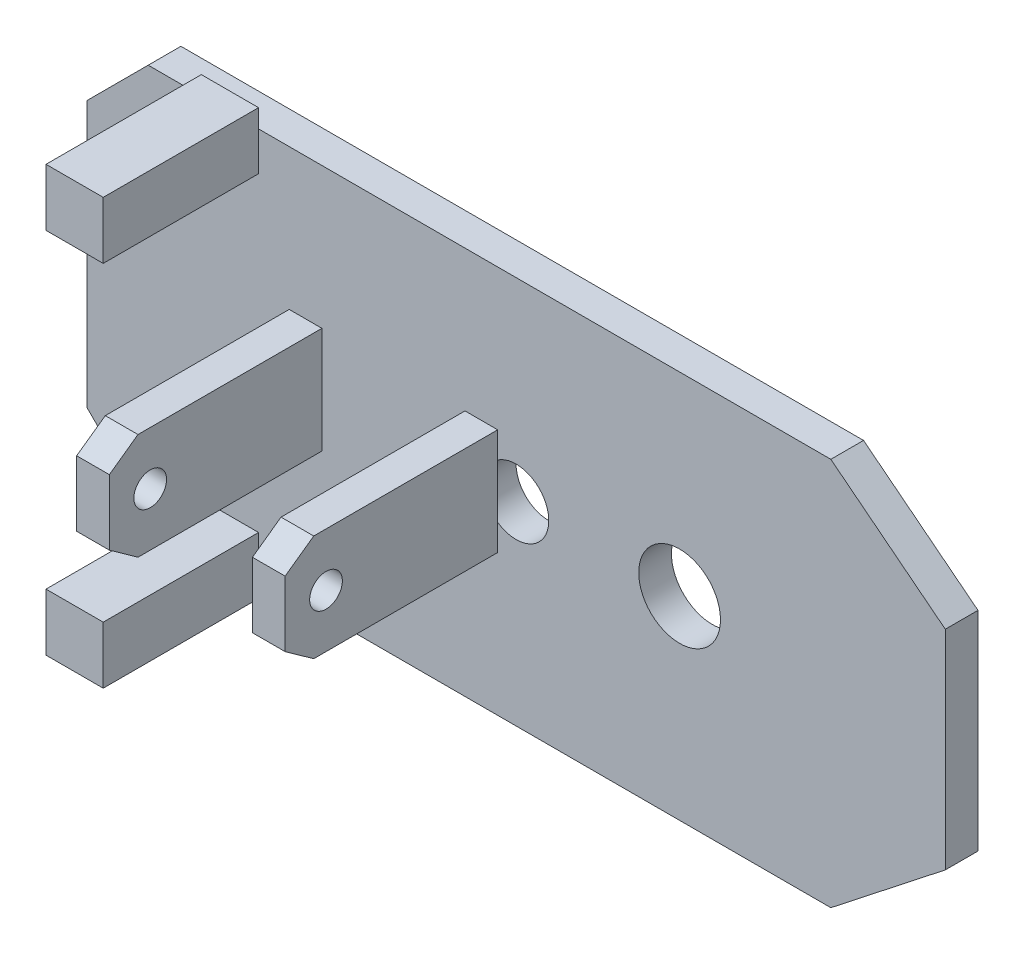
from build123d import *

# Parameters (mm, degrees)
SK_SOLE_PLATE_R    = 10
SK_SOLE_PLATE_R_2  = 8
SOLE_PLATE_DEPTH   = 8
SK_CLEVIS_FRONT_R  = 4
CLEVIS_FRONT_DEPTH = 8
SK_CLEVIS_BACK_R   = 4
CLEVIS_BACK_DEPTH  = 8
SK_POST_LAT_W      = 14
SK_POST_LAT_H      = 14
POST_LAT_DEPTH     = 38
SK_POST_MED_W      = 14
SK_POST_MED_H      = 14
POST_MED_DEPTH     = 38


with BuildPart() as part:
    # SK_Sole_Plate → Sole_Plate (new body)
    with BuildSketch(Plane.XY.offset(-50)):
        Polygon((-60, 47.5), (107, 47.5), (135, 25.5), (135, -25.5), (107, -47.5), (-60, -47.5), (-75, -32.5), (-75, 32.5), align=None)
        with Locations((70, 0)):
            Circle(SK_SOLE_PLATE_R, mode=Mode.SUBTRACT)
        with Locations((30, 0)):
            Circle(SK_SOLE_PLATE_R_2, mode=Mode.SUBTRACT)
    extrude(amount=SOLE_PLATE_DEPTH)

    # SK_Clevis_Front → Clevis_Front (add)
    with BuildSketch(Plane(origin=(17.5, 0, 0), x_dir=(0, 0, -1), z_dir=(1, 0, 0))):
        Polygon((42, 13), (42, -13), (-3, -13), (-10, -8), (-10, 8), (-3, 13), align=None)
        Circle(SK_CLEVIS_FRONT_R, mode=Mode.SUBTRACT)
    extrude(amount=CLEVIS_FRONT_DEPTH)

    # SK_Clevis_Back → Clevis_Back (add)
    with BuildSketch(Plane(origin=(-25.5, 0, 0), x_dir=(0, 0, -1), z_dir=(1, 0, 0))):
        Polygon((42, 13), (42, -13), (-3, -13), (-10, -8), (-10, 8), (-3, 13), align=None)
        Circle(SK_CLEVIS_BACK_R, mode=Mode.SUBTRACT)
    extrude(amount=CLEVIS_BACK_DEPTH)

    # SK_Post_Lat → Post_Lat (add)
    with BuildSketch(Plane.XY.offset(-42)):
        with Locations((-40, -45)):
            Rectangle(SK_POST_LAT_W, SK_POST_LAT_H)
    extrude(amount=POST_LAT_DEPTH)

    # SK_Post_Med → Post_Med (add)
    with BuildSketch(Plane.XY.offset(-42)):
        with Locations((-40, 45)):
            Rectangle(SK_POST_MED_W, SK_POST_MED_H)
    extrude(amount=POST_MED_DEPTH)


solid = part.part
